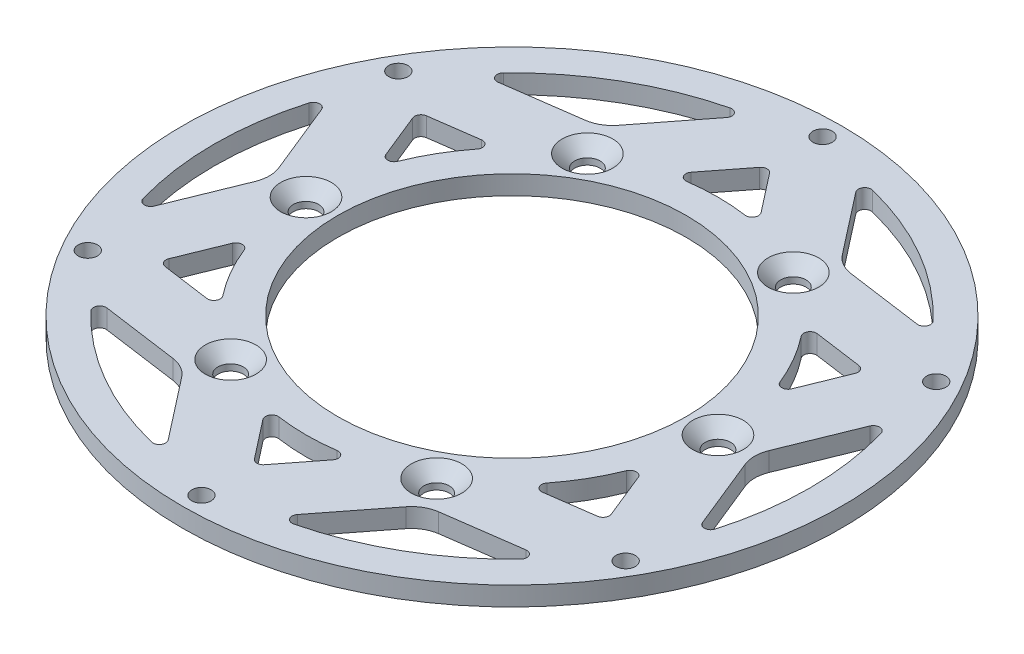
from build123d import *

# Parameters (mm, degrees)
SKETCH_1_R               = 52
SKETCH_1_R_2             = 1.525
SKETCH_1_R_3             = 2
SKETCH_1_R_4             = 27.5
EXTRUDE_1_DEPTH          = 3
HOLE_WIZARD_1_AT_2_COUNT = 2
HOLE_WIZARD_1_AT_2_PITCH = 32.5
HOLE_WIZARD_1_AT_3_COUNT = 2
HOLE_WIZARD_1_AT_3_PITCH = 56.291651246
HOLE_WIZARD_1_AT_4_COUNT = 2
HOLE_WIZARD_1_AT_4_PITCH = 65
HOLE_WIZARD_1_AT_5_COUNT = 2
HOLE_WIZARD_1_AT_5_PITCH = 56.291651246
HOLE_WIZARD_1_AT_6_COUNT = 2
HOLE_WIZARD_1_AT_6_PITCH = 32.5
CUT_EXTRUDE_1_DEPTH      = 10
FILLET_1_R               = 5
FILLET_2_R               = 1


with BuildPart() as part:
    # 草图1 → 凸台-拉伸1 (new body)
    with BuildSketch(Plane(origin=(0, 0, 0), x_dir=(1, 0, 0), z_dir=(0, 1, 0))):
        with Locations(Location((0, 0, 0), (0, 0, 270))):
            Circle(SKETCH_1_R)
        with Locations(Location((0, 49, 0), (0, 0, 270))):
            Circle(SKETCH_1_R_2, mode=Mode.SUBTRACT)
        with Locations(Location((-16.25, 28.145825623, 0), (0, 0, 270))):
            Circle(SKETCH_1_R_3, mode=Mode.SUBTRACT)
        with Locations(Location((42.435244785, 24.5, 0), (0, 0, 270))):
            Circle(SKETCH_1_R_2, mode=Mode.SUBTRACT)
        with Locations(Location((16.25, 28.145825623, 0), (0, 0, 270))):
            Circle(SKETCH_1_R_3, mode=Mode.SUBTRACT)
        with Locations(Location((42.435244785, -24.5, 0), (0, 0, 270))):
            Circle(SKETCH_1_R_2, mode=Mode.SUBTRACT)
        with Locations(Location((32.5, 0, 0), (0, 0, 270))):
            Circle(SKETCH_1_R_3, mode=Mode.SUBTRACT)
        with Locations(Location((0, -49, 0), (0, 0, 270))):
            Circle(SKETCH_1_R_2, mode=Mode.SUBTRACT)
        with Locations(Location((16.25, -28.145825623, 0), (0, 0, 270))):
            Circle(SKETCH_1_R_3, mode=Mode.SUBTRACT)
        with Locations(Location((-42.435244785, -24.5, 0), (0, 0, 270))):
            Circle(SKETCH_1_R_2, mode=Mode.SUBTRACT)
        with Locations(Location((-16.25, -28.145825623, 0), (0, 0, 270))):
            Circle(SKETCH_1_R_3, mode=Mode.SUBTRACT)
        with Locations(Location((-42.435244785, 24.5, 0), (0, 0, 270))):
            Circle(SKETCH_1_R_2, mode=Mode.SUBTRACT)
        with Locations(Location((-32.5, 0, 0), (0, 0, 270))):
            Circle(SKETCH_1_R_3, mode=Mode.SUBTRACT)
        with Locations(Location((0, 0, 0), (0, 0, 270))):
            Circle(SKETCH_1_R_4, mode=Mode.SUBTRACT)
    extrude(amount=EXTRUDE_1_DEPTH)

    # 草图3 → 孔1 (revolve, cut)
    with BuildSketch(Plane(origin=(-16.25, 3, -28.145825623), x_dir=(0, 0, 1), z_dir=(1, 0, 0))):
        Polygon((0, 0), (0, 3), (2, 3), (2, 2), (4, 0), align=None)
    hole_wizard_1 = revolve(axis=Axis((-16.25, 9.445314094, -28.145825623), (0, -1, 0)), mode=Mode.SUBTRACT)

    # 孔1 at 2: 孔1 ×2
    with Locations(*[(i * HOLE_WIZARD_1_AT_2_PITCH, 0, 0) for i in range(1, HOLE_WIZARD_1_AT_2_COUNT)]):
        add(hole_wizard_1, mode=Mode.SUBTRACT)

    # 孔1 at 3: 孔1 ×2
    with Locations(*[Vector(0.8660254037844387, 0, 0.5) * (i * HOLE_WIZARD_1_AT_3_PITCH) for i in range(1, HOLE_WIZARD_1_AT_3_COUNT)]):
        add(hole_wizard_1, mode=Mode.SUBTRACT)

    # 孔1 at 4: 孔1 ×2
    with Locations(*[Vector(0.5000000000000001, 0, 0.8660254037844386) * (i * HOLE_WIZARD_1_AT_4_PITCH) for i in range(1, HOLE_WIZARD_1_AT_4_COUNT)]):
        add(hole_wizard_1, mode=Mode.SUBTRACT)

    # 孔1 at 5: 孔1 ×2
    with Locations(*[(0, 0, i * HOLE_WIZARD_1_AT_5_PITCH) for i in range(1, HOLE_WIZARD_1_AT_5_COUNT)]):
        add(hole_wizard_1, mode=Mode.SUBTRACT)

    # 孔1 at 6: 孔1 ×2
    with Locations(*[Vector(-0.5000000000000003, 0, 0.8660254037844386) * (i * HOLE_WIZARD_1_AT_6_PITCH) for i in range(1, HOLE_WIZARD_1_AT_6_COUNT)]):
        add(hole_wizard_1, mode=Mode.SUBTRACT)

    # 草图5 → 切除-拉伸1 (cut)
    with BuildSketch(Plane(origin=(0, 3, 0), x_dir=(1, 0, 0), z_dir=(0, 1, 0))):
        with BuildLine():
            Line((-8.501262172, 46.22476113), (-18.947738206, 32.818445262))
            Line((-18.947738206, 32.818445262), (-35.781186336, 30.47468957))
            ThreePointArc((-35.781186336, 30.47468957), (-23.5, 40.703193978), (-8.501262172, 46.22476113))
        make_face()
        with BuildLine():
            Line((0, 40.865281716), (7.136483547, 31.706791111))
            ThreePointArc((7.136483547, 31.706791111), (0, 32.5), (-7.136483547, 31.706791111))
            Line((-7.136483547, 31.706791111), (0, 40.865281716))
        make_face()
        with BuildLine():
            Line((18.947738206, 32.818445262), (8.501262172, 46.22476113))
            ThreePointArc((8.501262172, 46.22476113), (23.5, 40.703193978), (35.781186336, 30.47468957))
            Line((35.781186336, 30.47468957), (18.947738206, 32.818445262))
        make_face()
        with BuildLine():
            Line((35.390372099, 20.432640858), (23.890644801, 22.033771601))
            ThreePointArc((23.890644801, 22.033771601), (28.145825623, 16.25), (31.027128348, 9.67301951))
            Line((31.027128348, 9.67301951), (35.390372099, 20.432640858))
        make_face()
        with BuildLine():
            Line((37.895476413, 0), (44.282448508, 15.75007156))
            ThreePointArc((44.282448508, 15.75007156), (47, 0), (44.282448508, -15.75007156))
            Line((44.282448508, -15.75007156), (37.895476413, 0))
        make_face()
        with BuildLine():
            Line((35.390372099, -20.432640858), (31.027128348, -9.67301951))
            ThreePointArc((31.027128348, -9.67301951), (28.145825623, -16.25), (23.890644801, -22.033771601))
            Line((23.890644801, -22.033771601), (35.390372099, -20.432640858))
        make_face()
        with BuildLine():
            Line((18.947738206, -32.818445262), (35.781186336, -30.47468957))
            ThreePointArc((35.781186336, -30.47468957), (23.5, -40.703193978), (8.501262172, -46.22476113))
            Line((8.501262172, -46.22476113), (18.947738206, -32.818445262))
        make_face()
        with BuildLine():
            Line((0, -40.865281716), (7.136483547, -31.706791111))
            ThreePointArc((7.136483547, -31.706791111), (0, -32.5), (-7.136483547, -31.706791111))
            Line((-7.136483547, -31.706791111), (0, -40.865281716))
        make_face()
        with BuildLine():
            Line((-18.947738206, -32.818445262), (-8.501262172, -46.22476113))
            ThreePointArc((-8.501262172, -46.22476113), (-23.5, -40.703193978), (-35.781186336, -30.47468957))
            Line((-35.781186336, -30.47468957), (-18.947738206, -32.818445262))
        make_face()
        with BuildLine():
            Line((-35.390372099, -20.432640858), (-23.890644801, -22.033771601))
            ThreePointArc((-23.890644801, -22.033771601), (-28.145825623, -16.25), (-31.027128348, -9.67301951))
            Line((-31.027128348, -9.67301951), (-35.390372099, -20.432640858))
        make_face()
        with BuildLine():
            Line((-37.895476413, 0), (-44.282448508, -15.75007156))
            ThreePointArc((-44.282448508, -15.75007156), (-47, 0), (-44.282448508, 15.75007156))
            Line((-44.282448508, 15.75007156), (-37.895476413, 0))
        make_face()
        with BuildLine():
            Line((-35.390372099, 20.432640858), (-31.027128348, 9.67301951))
            ThreePointArc((-31.027128348, 9.67301951), (-28.145825623, 16.25), (-23.890644801, 22.033771601))
            Line((-23.890644801, 22.033771601), (-35.390372099, 20.432640858))
        make_face()
    extrude(amount=-CUT_EXTRUDE_1_DEPTH, mode=Mode.SUBTRACT)

    # 圆角1
    fillet_1_edges = [part.edges().sort_by_distance(p)[0] for p in [
        (-18.947738206, 1.5, 32.818445262),
        (18.947738206, 1.5, 32.818445262),
        (37.895476413, 1.5, 0),
        (18.947738206, 1.5, -32.818445262),
        (-37.895476413, 1.5, 0),
        (-18.947738206, 1.5, -32.818445262),
    ]]
    fillet(fillet_1_edges, radius=FILLET_1_R)

    # 圆角2
    fillet_2_edges = [part.edges().sort_by_distance(p)[0] for p in [
        (-8.501262172, 1.5, 46.22476113),
        (-35.781186336, 1.5, 30.47468957),
        (0, 1.5, 40.865281716),
        (-7.136483547, 1.5, 31.706791111),
        (7.136483547, 1.5, 31.706791111),
        (35.781186336, 1.5, 30.47468957),
        (8.501262172, 1.5, 46.22476113),
        (35.390372099, 1.5, 20.432640858),
        (23.890644801, 1.5, 22.033771601),
        (31.027128348, 1.5, 9.67301951),
        (44.282448508, 1.5, -15.75007156),
        (44.282448508, 1.5, 15.75007156),
        (35.390372099, 1.5, -20.432640858),
        (31.027128348, 1.5, -9.67301951),
        (23.890644801, 1.5, -22.033771601),
        (8.501262172, 1.5, -46.22476113),
        (35.781186336, 1.5, -30.47468957),
        (-7.136483547, 1.5, -31.706791111),
        (0, 1.5, -40.865281716),
        (7.136483547, 1.5, -31.706791111),
        (-35.390372099, 1.5, -20.432640858),
        (-23.890644801, 1.5, -22.033771601),
        (-31.027128348, 1.5, -9.67301951),
        (-44.282448508, 1.5, 15.75007156),
        (-44.282448508, 1.5, -15.75007156),
        (-35.390372099, 1.5, 20.432640858),
        (-31.027128348, 1.5, 9.67301951),
        (-23.890644801, 1.5, 22.033771601),
        (-35.781186336, 1.5, -30.47468957),
        (-8.501262172, 1.5, -46.22476113),
    ]]
    fillet(fillet_2_edges, radius=FILLET_2_R)


solid = part.part
